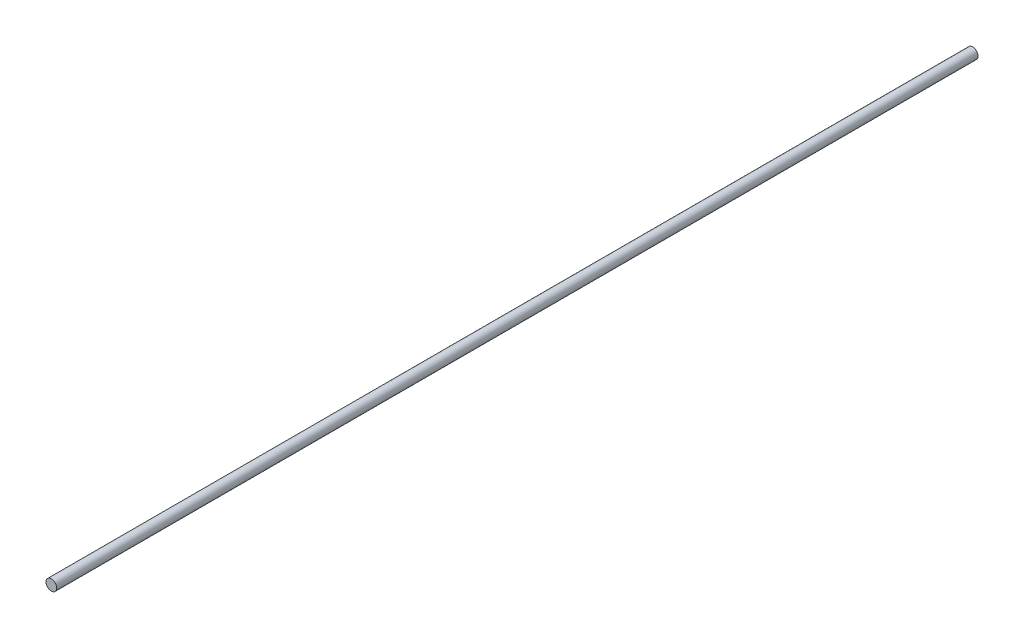
from build123d import *

# Parameters (mm, degrees)
SKETCH_1_R      = 2.5
EXTRUDE_1_DEPTH = 433.07


with BuildPart() as part:
    # 草图1 → 凸台-拉伸1 (new body)
    with BuildSketch(Plane.XY):
        with Locations((0, -0.19639398)):
            Circle(SKETCH_1_R)
    extrude(amount=EXTRUDE_1_DEPTH)


solid = part.part
